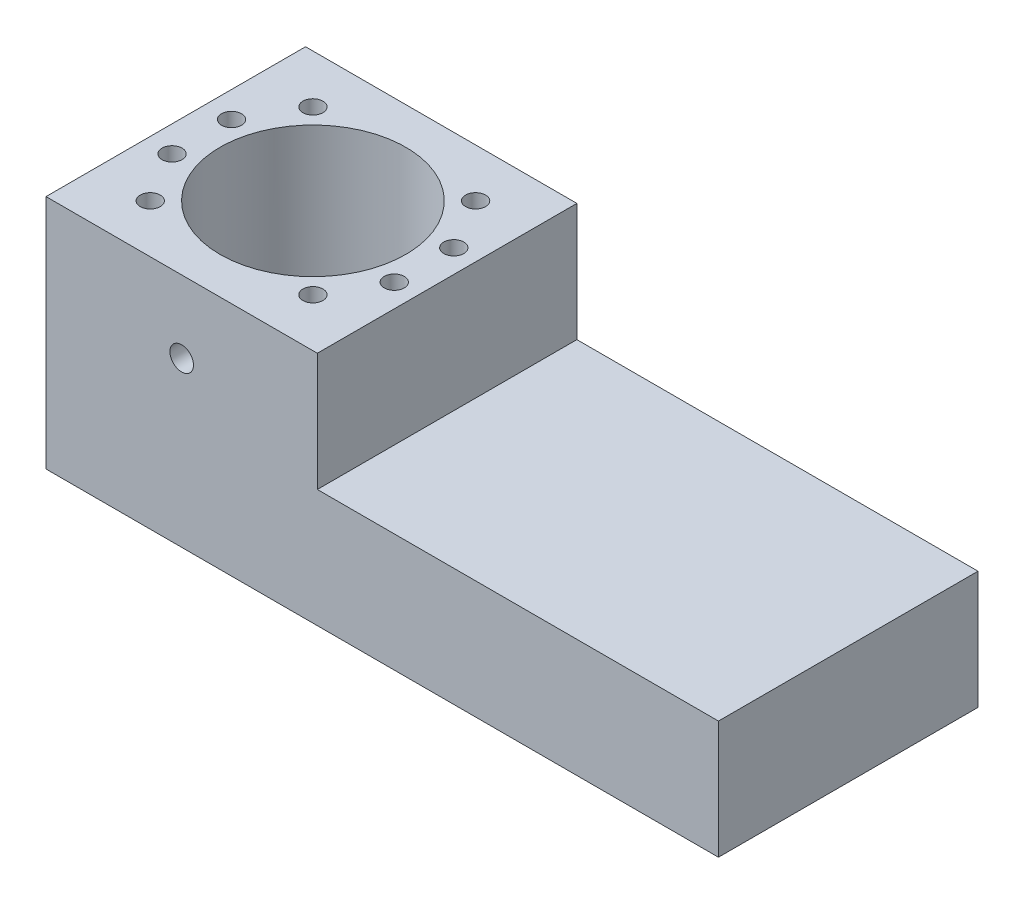
from build123d import *

# Parameters (mm, degrees)
SKETCH_2_W               = 228
SKETCH_2_H               = 88
EXTRUDE_1_DEPTH          = 40
SKETCH_3_W               = 92
SKETCH_3_H               = 88
EXTRUDE_2_DEPTH          = 40
CUT_EXTRUDE_1_REACH      = 259.154
SKETCH_4_R               = 31.5
HOLE_WIZARD_M8_3_D       = 6.8
HOLE_WIZARD_M8_3_DEPTH   = 30
HOLE_WIZARD_M8_3_TIP     = 2.042926105
CUT_EXTRUDE_3_REACH      = 259.154
CUT_EXTRUDE_3_END_RADIUS = 31.5
SKETCH_8_R               = 4


with BuildPart() as part:
    # 草图2 → 凸台-拉伸1 (new body)
    with BuildSketch(Plane(origin=(0, 0, 0), x_dir=(1, 0, 0), z_dir=(0, 1, 0))):
        with Locations((114, 44)):
            Rectangle(SKETCH_2_W, SKETCH_2_H)
    extrude(amount=EXTRUDE_1_DEPTH)

    # 草图3 → 凸台-拉伸2 (add)
    with BuildSketch(Plane(origin=(0, 40, 0), x_dir=(1, 0, 0), z_dir=(0, 1, 0))):
        with Locations((46, 44)):
            Rectangle(SKETCH_3_W, SKETCH_3_H)
    extrude(amount=EXTRUDE_2_DEPTH)

    # 草图4 → 切除-拉伸1 (cut, up to next)
    with BuildSketch(Plane(origin=(0, 80, 0), x_dir=(1, 0, 0), z_dir=(0, 1, 0)), mode=Mode.PRIVATE) as cut_extrude_1_sk1:
        with Locations(Location((46.5, 44, 0), (0, 0, 270))):
            Circle(SKETCH_4_R)
    cut_extrude_1_tool1 = extrude(cut_extrude_1_sk1.sketch, amount=-CUT_EXTRUDE_1_REACH, mode=Mode.PRIVATE) & part.part
    add(cut_extrude_1_tool1.solids().sort_by_distance((46.5, 80, -44))[0], mode=Mode.SUBTRACT)

    # M8 螺纹孔3
    with Locations(Plane(origin=(0, 80, 0), x_dir=(1, 0, 0), z_dir=(0, 1, 0))):
        with Locations((74.077164466, 71.577164466), (8.828892775, 54.093942759), (18.922835534, 16.422835534), (8.828892775, 33.906057241), (74.077164466, 16.422835534), (18.922835534, 71.577164466), (84.171107225, 33.906057241), (84.171107225, 54.093942759)):
            Hole(HOLE_WIZARD_M8_3_D / 2, depth=HOLE_WIZARD_M8_3_DEPTH)
            with Locations((0, 0, -(HOLE_WIZARD_M8_3_DEPTH + HOLE_WIZARD_M8_3_TIP / 2))):  # 118° drill point
                Cone(0, HOLE_WIZARD_M8_3_D / 2, HOLE_WIZARD_M8_3_TIP, mode=Mode.SUBTRACT)

    # 切除-拉伸3: up to this cylinder (the profile starts outside it)
    cut_extrude_3_end = Plane(origin=(46.5, 55.496491, -44), z_dir=(0, 1, 0)) * Cylinder(CUT_EXTRUDE_3_END_RADIUS, 582.308, mode=Mode.PRIVATE)
    # 草图8 → 切除-拉伸3 (cut, up to the surface)
    with BuildSketch(Plane.XY, mode=Mode.PRIVATE) as cut_extrude_3_sk1:
        with Locations((46, 55.496491008)):
            Circle(SKETCH_8_R)
    cut_extrude_3_tool1 = extrude(cut_extrude_3_sk1.sketch, amount=-CUT_EXTRUDE_3_REACH, mode=Mode.PRIVATE) - cut_extrude_3_end
    add(cut_extrude_3_tool1.solids().sort_by_distance((46, 55.496491, 0))[0], mode=Mode.SUBTRACT)


solid = part.part
